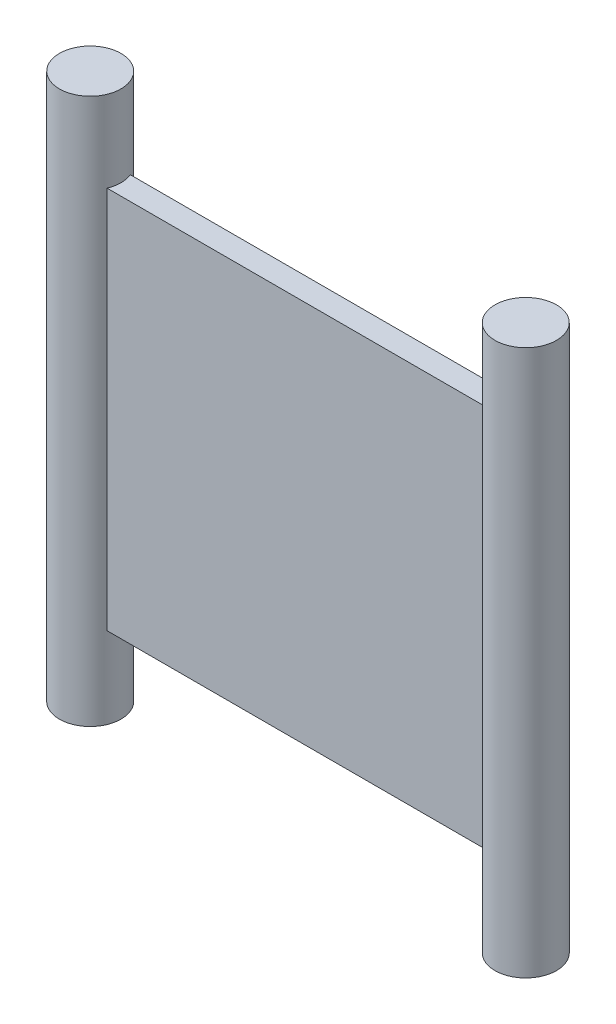
from build123d import *

# Parameters (mm, degrees)
SKETCH1_W           = 18.75
SKETCH1_H           = 1
BOSS_EXTRUDE1_DEPTH = 16.5
SKETCH2_R           = 1.325
BOSS_EXTRUDE2_DEPTH = 11.75


with BuildPart() as part:
    # Sketch1 → Boss-Extrude1 (new body)
    with BuildSketch(Plane(origin=(0, 0, 0), x_dir=(1, 0, 0), z_dir=(0, 1, 0))):
        Rectangle(SKETCH1_W, SKETCH1_H)
    extrude(amount=BOSS_EXTRUDE1_DEPTH)

    # Sketch2 → Boss-Extrude2 (add, symmetric)
    with BuildSketch(Plane(origin=(0, 8.25, 0), x_dir=(1, 0, 0), z_dir=(0, 1, 0))):
        with Locations(Location((-9.375, 0, 0), (0, 0, 270))):
            Circle(SKETCH2_R)
        with Locations(Location((9.375, 0, 0), (0, 0, 270))):
            Circle(SKETCH2_R)
    extrude(amount=BOSS_EXTRUDE2_DEPTH, both=True)


solid = part.part
